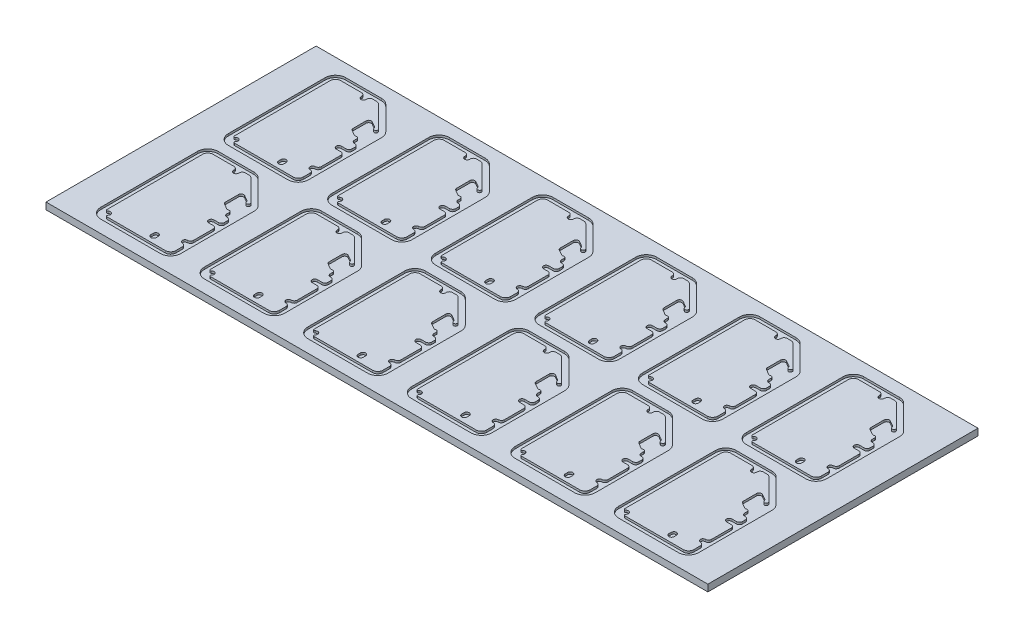
from build123d import *

# Parameters (mm, degrees)
SKETCH1_W            = 622.3
SKETCH1_H            = 254
BOSS_EXTRUDE1_DEPTH  = 6.35
CUT_EXTRUDE1_DEPTH   = 2
LPATTERN1_COUNT      = 6
LPATTERN1_PITCH      = 97.4
LPATTERN1_COUNT_DIR2 = 2
LPATTERN1_PITCH_DIR2 = 120


with BuildPart() as part:
    # Sketch1 → Boss-Extrude1 (new body)
    with BuildSketch(Plane(origin=(0, 0, 0), x_dir=(1, 0, 0), z_dir=(0, 1, 0))):
        Rectangle(SKETCH1_W, SKETCH1_H)
    extrude(amount=BOSS_EXTRUDE1_DEPTH)

    # Sketch5 → Cut-Extrude1 (cut)
    # profile 1 of 2: a face of its own
    with BuildSketch(Plane(origin=(0, 6.35, 0), x_dir=(1, 0, 0), z_dir=(0, 1, 0))):
        with BuildLine():
            ThreePointArc((-231.02712234, 112.336838691), (-234.163890594, 114.43276023), (-237.863961031, 115.16875))
            Line((-237.863961031, 115.16875), (-271.5, 115.16875))
            ThreePointArc((-271.5, 115.16875), (-278.336838691, 112.336838691), (-281.16875, 105.5))
            Line((-281.16875, 105.5), (-281.16875, 14.5))
            ThreePointArc((-281.16875, 14.5), (-278.336838691, 7.663161309), (-271.5, 4.83125))
            Line((-271.5, 4.83125), (-215.5, 4.83125))
            ThreePointArc((-215.5, 4.83125), (-208.663161309, 7.663161309), (-205.83125, 14.5))
            Line((-205.83125, 14.5), (-205.83125, 83.136038969))
            ThreePointArc((-205.83125, 83.136038969), (-206.56723977, 86.836109406), (-208.663161309, 89.97287766))
            Line((-208.663161309, 89.97287766), (-231.02712234, 112.336838691))
        make_face()
        with BuildLine():
            ThreePointArc((-217.745999994, 57.401750001), (-220.189749994, 54.958000001), (-217.745999994, 52.514250001))
            Line((-217.745999994, 52.514250001), (-213.5, 52.514250001))
            ThreePointArc((-213.5, 52.514250001), (-211.444970917, 51.663029084), (-210.59375, 49.608000001))
            Line((-210.59375, 49.608000001), (-210.59375, 31.2875))
            ThreePointArc((-210.59375, 31.2875), (-211.444970917, 29.232470917), (-213.5, 28.38125))
            ThreePointArc((-213.5, 28.38125), (-215.88125, 26), (-213.5, 23.61875))
            ThreePointArc((-213.5, 23.61875), (-211.444970917, 22.767529083), (-210.59375, 20.7125))
            Line((-210.59375, 20.7125), (-210.59375, 14.5))
            ThreePointArc((-210.59375, 14.5), (-212.030757355, 11.030757355), (-215.5, 9.59375))
            Line((-215.5, 9.59375), (-270.481418664, 9.59375))
            ThreePointArc((-270.481418664, 9.59375), (-271.460030242, 10.247637351), (-271.23041554, 11.401988415))
            ThreePointArc((-271.23041554, 11.401988415), (-271.23041554, 14.76958446), (-274.598011585, 14.76958446))
            ThreePointArc((-274.598011585, 14.76958446), (-275.752362649, 14.539969758), (-276.40625, 15.518581336))
            Line((-276.40625, 15.518581336), (-276.40625, 105.5))
            ThreePointArc((-276.40625, 105.5), (-274.969242645, 108.969242645), (-271.5, 110.40625))
            Line((-271.5, 110.40625), (-251.763806251, 110.40625))
            ThreePointArc((-251.763806251, 110.40625), (-249.613807121, 109.455452071), (-248.870579411, 107.225177305))
            ThreePointArc((-248.870579411, 107.225177305), (-246.5, 104.61875), (-244.129420589, 107.225177305))
            ThreePointArc((-244.129420589, 107.225177305), (-243.386192879, 109.455452071), (-241.236193749, 110.40625))
            Line((-241.236193749, 110.40625), (-237.863961031, 110.40625))
            ThreePointArc((-237.863961031, 110.40625), (-235.986420441, 110.032783956), (-234.394718385, 108.969242645))
            Line((-234.394718385, 108.969242645), (-214.239221426, 88.813745685))
            ThreePointArc((-214.239221426, 88.813745685), (-214.652754, 86.083110193), (-217.138501313, 87.28662159))
            ThreePointArc((-217.138501313, 87.28662159), (-217.545905963, 88.250362287), (-218.319036087, 88.95537611))
            Line((-218.319036087, 88.95537611), (-223.081213914, 91.704820761))
            ThreePointArc((-223.081213914, 91.704820761), (-225.524963914, 91.704820761), (-226.746838914, 89.58847118))
            Line((-226.746838914, 89.58847118), (-226.746838914, 77.348645473))
            ThreePointArc((-226.746838914, 77.348645473), (-226.419438494, 76.126770473), (-225.524963914, 75.232295893))
            Line((-225.524963914, 75.232295893), (-220.762786087, 72.482851243))
            ThreePointArc((-220.762786087, 72.482851243), (-219.781396679, 72.167312515), (-218.757213354, 72.284523324))
            ThreePointArc((-218.757213354, 72.284523324), (-217.207401784, 72.053696252), (-216.49175, 70.659766711))
            Line((-216.49175, 70.659766711), (-216.49175, 68.166))
            ThreePointArc((-216.49175, 68.166), (-215.685102847, 66.351665871), (-213.797686916, 65.735103576))
            ThreePointArc((-213.797686916, 65.735103576), (-211.553061832, 65.001851742), (-210.59375, 62.844139799))
            Line((-210.59375, 62.844139799), (-210.59375, 60.308000001))
            ThreePointArc((-210.59375, 60.308000001), (-211.444970917, 58.252970918), (-213.5, 57.401750001))
            Line((-213.5, 57.401750001), (-217.745999994, 57.401750001))
        make_face(mode=Mode.SUBTRACT)
    # profile 2 of 2: a face of its own
    with BuildSketch(Plane(origin=(0, 6.35, 0), x_dir=(1, 0, 0), z_dir=(0, 1, 0))):
        with BuildLine():
            ThreePointArc((-230.400249999, 17.997878003), (-232.843999999, 20.441628003), (-235.287749999, 17.997878003))
            Line((-235.287749999, 17.997878003), (-235.287749999, 15.797878003))
            ThreePointArc((-235.287749999, 15.797878003), (-232.843999999, 13.354128003), (-230.400249999, 15.797878003))
            Line((-230.400249999, 15.797878003), (-230.400249999, 17.997878003))
        make_face()
    cut_extrude1 = extrude(amount=-CUT_EXTRUDE1_DEPTH, mode=Mode.SUBTRACT)

    # LPattern1: Cut-Extrude1 6 × 2
    with Locations(*[(i * LPATTERN1_PITCH, 0, j * LPATTERN1_PITCH_DIR2) for i in range(LPATTERN1_COUNT) for j in range(LPATTERN1_COUNT_DIR2) if (i, j) != (0, 0)]):
        add(cut_extrude1, mode=Mode.SUBTRACT)


solid = part.part
